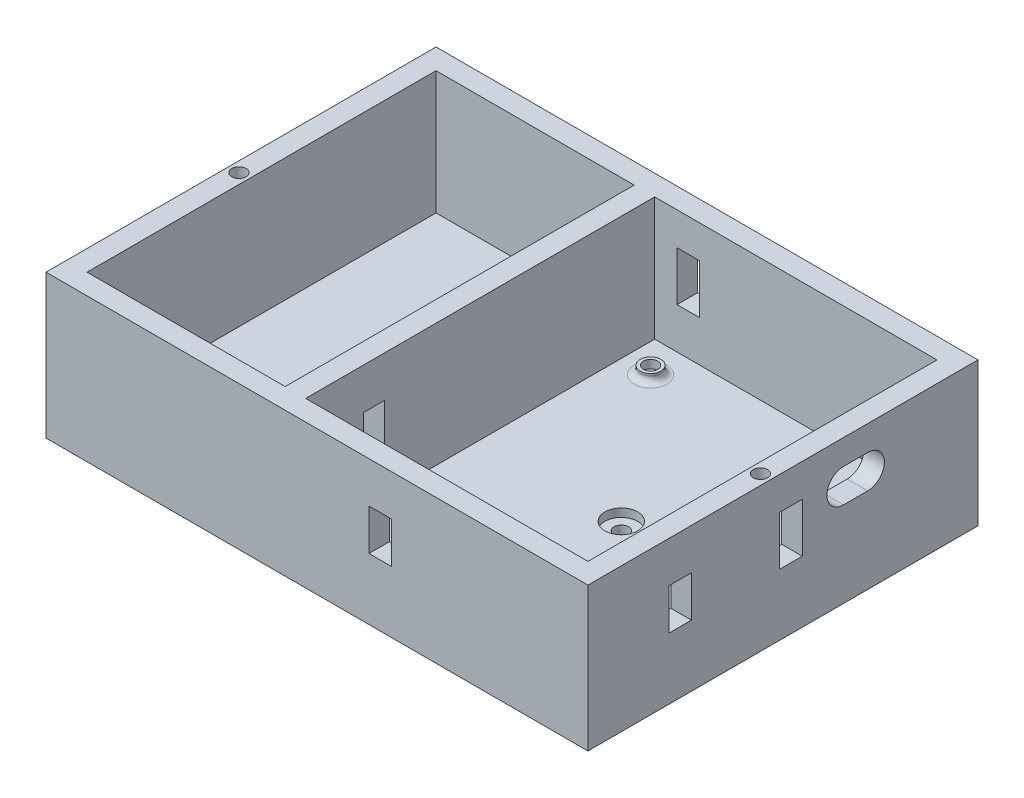
from build123d import *

# Parameters (mm, degrees)
SKETCH1_W           = 132
SKETCH1_H           = 95
BOSS_EXTRUDE1_DEPTH = 35
SKETCH2_W           = 122
SKETCH2_H           = 85
CUT_EXTRUDE1_DEPTH  = 30
SKETCH4_W           = 5
SKETCH4_H           = 85
BOSS_EXTRUDE2_DEPTH = 30
SKETCH5_R           = 2.5
SKETCH5_R_2         = 1.75
BOSS_EXTRUDE3_DEPTH = 2
FILLET1_R           = 1.5
SKETCH7_W           = 5
SKETCH7_H           = 10
CUT_EXTRUDE3_DEPTH  = 10
SKETCH8_R           = 1.75
SKETCH8_R_2         = 1.7
CUT_EXTRUDE4_DEPTH  = 10
SKETCH9_R           = 4
CUT_EXTRUDE6_DEPTH  = 2
SKETCH11_W          = 5.5
SKETCH11_H          = 12
SKETCH11_H_2        = 10
CUT_EXTRUDE7_DEPTH  = 10
SKETCH13_W          = 5.5
SKETCH13_H          = 10
CUT_EXTRUDE8_DEPTH  = 10
SKETCH14_W          = 5.5
SKETCH14_H          = 12
CUT_EXTRUDE9_DEPTH  = 10
SKETCH15_R          = 1.75
CUT_EXTRUDE10_DEPTH = 10


with BuildPart() as part:
    # Sketch1 → Boss-Extrude1 (new body)
    with BuildSketch(Plane(origin=(0, 0, 0), x_dir=(1, 0, 0), z_dir=(0, 1, 0))):
        Rectangle(SKETCH1_W, SKETCH1_H)
    extrude(amount=BOSS_EXTRUDE1_DEPTH)

    # Sketch2 → Cut-Extrude1 (cut)
    with BuildSketch(Plane(origin=(0, 35, 0), x_dir=(1, 0, 0), z_dir=(0, 1, 0))):
        Rectangle(SKETCH2_W, SKETCH2_H)
    extrude(amount=-CUT_EXTRUDE1_DEPTH, mode=Mode.SUBTRACT)

    # Sketch4 → Boss-Extrude2 (add, through all)
    with BuildSketch(Plane(origin=(0, 5, 0), x_dir=(1, 0, 0), z_dir=(0, 1, 0))):
        with Locations((-10.25, 0)):
            Rectangle(SKETCH4_W, SKETCH4_H)
    extrude(amount=BOSS_EXTRUDE2_DEPTH)

    # Sketch5 → Boss-Extrude3 (add)
    # profile 1 of 4: a face of its own
    with BuildSketch(Plane(origin=(0, 5, 0), x_dir=(1, 0, 0), z_dir=(0, 1, 0))):
        with Locations(Location((55.55, -35.5, 0), (0, 0, 270))):
            Circle(SKETCH5_R)
        with Locations(Location((55.55, -35.5, 0), (0, 0, 270))):
            Circle(SKETCH5_R_2, mode=Mode.SUBTRACT)
    # profile 2 of 4: a face of its own
    with BuildSketch(Plane(origin=(0, 5, 0), x_dir=(1, 0, 0), z_dir=(0, 1, 0))):
        with Locations(Location((-0.75, -35.5, 0), (0, 0, 270))):
            Circle(SKETCH5_R)
        with Locations(Location((-0.75, -35.5, 0), (0, 0, 270))):
            Circle(SKETCH5_R_2, mode=Mode.SUBTRACT)
    # profile 3 of 4: a face of its own
    with BuildSketch(Plane(origin=(0, 5, 0), x_dir=(1, 0, 0), z_dir=(0, 1, 0))):
        with Locations(Location((55.249999996, 34.49935714, 0), (0, 0, 270))):
            Circle(SKETCH5_R)
        with Locations(Location((55.249999996, 34.49935714, 0), (0, 0, 270))):
            Circle(SKETCH5_R_2, mode=Mode.SUBTRACT)
    # profile 4 of 4: a face of its own
    with BuildSketch(Plane(origin=(0, 5, 0), x_dir=(1, 0, 0), z_dir=(0, 1, 0))):
        with Locations(Location((-0.75, 34.5, 0), (0, 0, 270))):
            Circle(SKETCH5_R)
        with Locations(Location((-0.75, 34.5, 0), (0, 0, 270))):
            Circle(SKETCH5_R_2, mode=Mode.SUBTRACT)
    extrude(amount=BOSS_EXTRUDE3_DEPTH)

    # Fillet1
    fillet1_edges = [part.edges().sort_by_distance(p)[0] for p in [
        (55.55, 5, 33),
        (-0.75, 5, 33),
        (55.249999996, 5, -36.99935714),
        (-0.75, 5, -37),
    ]]
    fillet(fillet1_edges, radius=FILLET1_R)

    # Sketch7 → Cut-Extrude3 (cut)
    with BuildSketch(Plane(origin=(-7.75, 0, 0), x_dir=(0, 0, -1), z_dir=(1, 0, 0))):
        with Locations((-25.863290262, 20)):
            Rectangle(SKETCH7_W, SKETCH7_H)
    extrude(amount=-CUT_EXTRUDE3_DEPTH, mode=Mode.SUBTRACT)

    # Sketch8 → Cut-Extrude4 (cut)
    with BuildSketch(Plane(origin=(0, 5, 0), x_dir=(1, 0, 0), z_dir=(0, 1, 0))):
        with Locations(Location((26.625, 0, 0), (0, 0, 270))):
            Circle(SKETCH8_R)
        with Locations(Location((-36.875, 0, 0), (0, 0, 270))):
            Circle(SKETCH8_R_2)
    extrude(amount=-CUT_EXTRUDE4_DEPTH, mode=Mode.SUBTRACT)

    # Sketch9 → Cut-Extrude6 (cut)
    with BuildSketch(Plane(origin=(0, 5, 0), x_dir=(1, 0, 0), z_dir=(0, 1, 0))):
        with Locations(Location((26.625, 0, 0), (0, 0, 270))):
            Circle(SKETCH9_R)
        with Locations(Location((-36.875, 0, 0), (0, 0, 270))):
            Circle(SKETCH9_R)
    extrude(amount=-CUT_EXTRUDE6_DEPTH, mode=Mode.SUBTRACT)

    # Sketch11 → Cut-Extrude7 (cut)
    with BuildSketch(Plane.ZY.offset(-61)):
        with Locations((-1.95, 21)):
            Rectangle(SKETCH11_W, SKETCH11_H)
        with Locations((25.05, 20)):
            Rectangle(SKETCH11_W, SKETCH11_H_2)
        with BuildLine():
            Line((-14.75, 20.8), (-20.65, 20.8))
            ThreePointArc((-20.65, 20.8), (-24.7, 24.85), (-20.65, 28.9))
            Line((-20.65, 28.9), (-14.75, 28.9))
            ThreePointArc((-14.75, 28.9), (-10.7, 24.85), (-14.75, 20.8))
        make_face()
    extrude(amount=-CUT_EXTRUDE7_DEPTH, mode=Mode.SUBTRACT)

    # Sketch13 → Cut-Extrude8 (cut)
    with BuildSketch(Plane(origin=(0, 0, 42.5), x_dir=(-1, 0, 0), z_dir=(0, 0, -1))):
        with Locations((-15.42, 20)):
            Rectangle(SKETCH13_W, SKETCH13_H)
    extrude(amount=-CUT_EXTRUDE8_DEPTH, mode=Mode.SUBTRACT)

    # Sketch14 → Cut-Extrude9 (cut)
    with BuildSketch(Plane.XY.offset(-42.5)):
        with Locations((0.43, 21)):
            Rectangle(SKETCH14_W, SKETCH14_H)
    extrude(amount=-CUT_EXTRUDE9_DEPTH, mode=Mode.SUBTRACT)

    # Sketch15 → Cut-Extrude10 (cut)
    with BuildSketch(Plane(origin=(0, 35, 0), x_dir=(1, 0, 0), z_dir=(0, 1, 0))):
        with Locations(Location((-63.5, -3, 0), (0, 0, 270))):
            Circle(SKETCH15_R)
        with Locations(Location((63.5, -3, 0), (0, 0, 90))):
            Circle(SKETCH15_R)
    extrude(amount=-CUT_EXTRUDE10_DEPTH, mode=Mode.SUBTRACT)


solid = part.part
